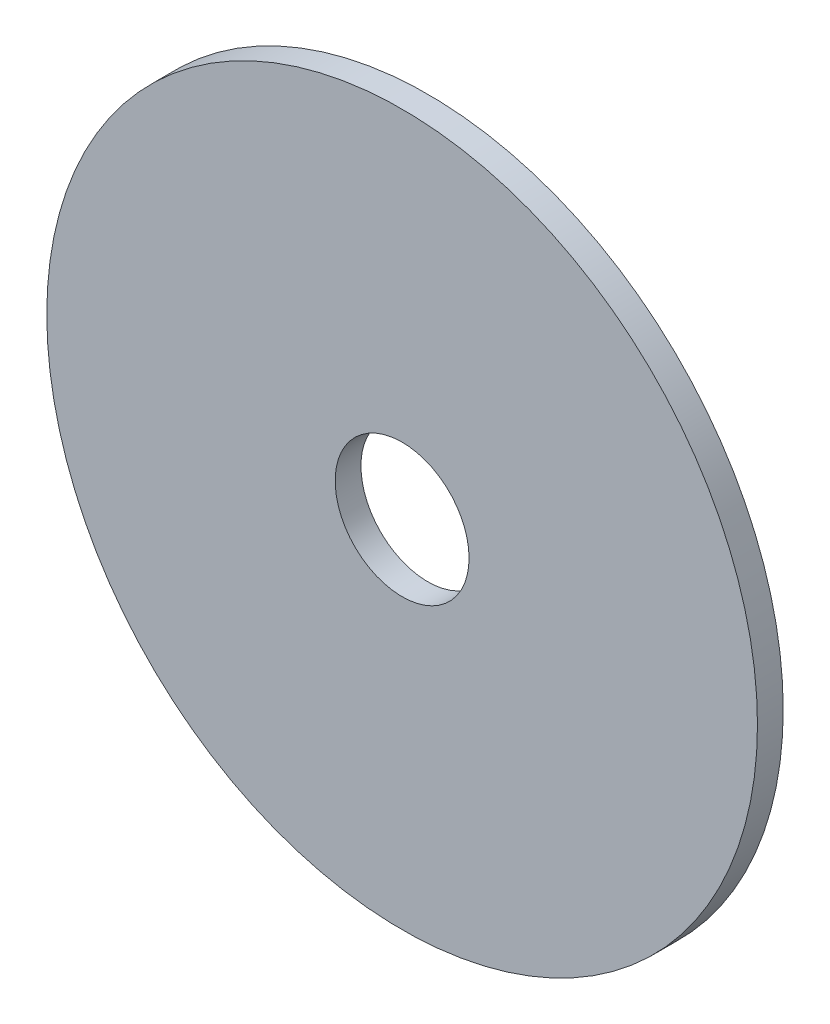
from build123d import *

# Parameters (mm, degrees)
SKETCH1_R           = 17.526
SKETCH1_R_2         = 3.302
BOSS_EXTRUDE1_DEPTH = 0.635


with BuildPart() as part:
    # Sketch1 → Boss-Extrude1 (new, symmetric)
    with BuildSketch(Plane.XY):
        Circle(SKETCH1_R)
        Circle(SKETCH1_R_2, mode=Mode.SUBTRACT)
    extrude(amount=BOSS_EXTRUDE1_DEPTH, both=True)


solid = part.part
